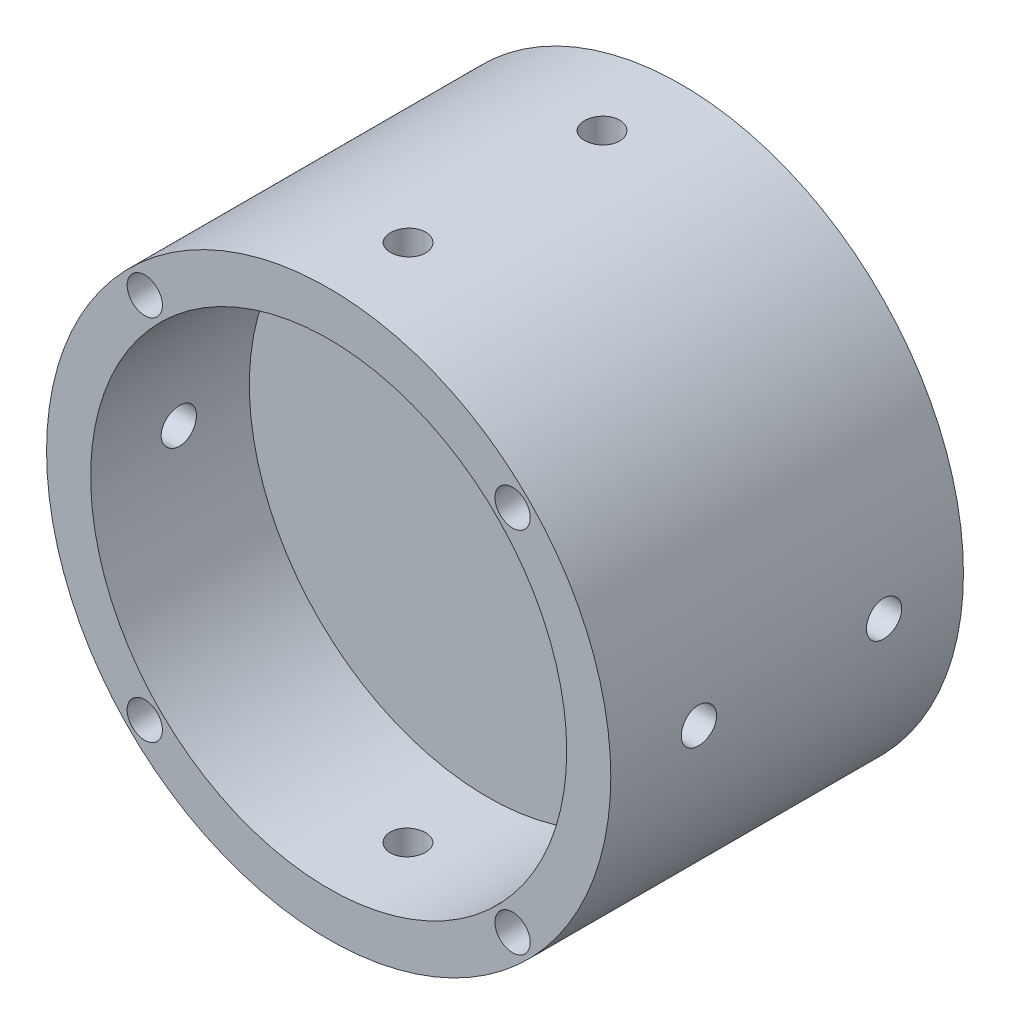
from build123d import *

# Parameters (mm, degrees)
SKETCH1_R               = 80
BOSS_EXTRUDE1_DEPTH     = 100
SKETCH3_R               = 67.5
CUT_EXTRUDE1_DEPTH      = 45
CUT_EXTRUDE5_START      = 45
SKETCH2_R               = 67.5
CUT_EXTRUDE5_DEPTH      = 45
CUT_EXTRUDE6_DEPTH      = 106
CUT_EXTRUDE6_DEPTH_BACK = 92
SKETCH5_R               = 5
CUT_EXTRUDE7_DEPTH      = 98
CUT_EXTRUDE7_DEPTH_BACK = 120
SKETCH5_3_R             = 5
CUT_EXTRUDE8_DEPTH      = 118
CUT_EXTRUDE8_DEPTH_BACK = 146
SKETCH6_R               = 5
SKETCH7_R               = 5
CUT_EXTRUDE15_DEPTH     = 118


with BuildPart() as part:
    # Sketch1 → Boss-Extrude1 (new body)
    with BuildSketch(Plane.XY):
        Circle(SKETCH1_R)
    extrude(amount=BOSS_EXTRUDE1_DEPTH)

    # Sketch3 → Cut-Extrude1 (cut)
    with BuildSketch(Plane.XY.offset(100)):
        Circle(SKETCH3_R)
    extrude(amount=-CUT_EXTRUDE1_DEPTH, mode=Mode.SUBTRACT)

    # Sketch2 → Cut-Extrude5 (cut)
    with BuildSketch(Plane.XY.offset(CUT_EXTRUDE5_START)):
        Circle(SKETCH2_R)
    extrude(amount=-CUT_EXTRUDE5_DEPTH, mode=Mode.SUBTRACT)

    # Sketch5 → Cut-Extrude6 (cut, two sides: drawn at the far end of the back side and taken through both)
    with BuildSketch(Plane(origin=(0, 0, 0), x_dir=(0, 0, -1), z_dir=(1, 0, 0)).offset(-CUT_EXTRUDE6_DEPTH_BACK)):
        with Locations((-75, 0)):
            Circle(SKETCH5_R)
    extrude(amount=CUT_EXTRUDE6_DEPTH + CUT_EXTRUDE6_DEPTH_BACK, mode=Mode.SUBTRACT)

    # Sketch5<3> → Cut-Extrude7 (cut, two sides: drawn at the far end of the back side and taken through both)
    with BuildSketch(Plane(origin=(0, 0, 0), x_dir=(0, 0, -1), z_dir=(1, 0, 0)).offset(-CUT_EXTRUDE7_DEPTH_BACK)):
        with Locations((-75, 0)):
            Circle(SKETCH5_3_R)
        with Locations((-22.5, 0)):
            Circle(SKETCH5_3_R)
    extrude(amount=CUT_EXTRUDE7_DEPTH + CUT_EXTRUDE7_DEPTH_BACK, mode=Mode.SUBTRACT)

    # Sketch6 → Cut-Extrude8 (cut, two sides: drawn at the far end of the back side and taken through both)
    with BuildSketch(Plane(origin=(0, 0, 0), x_dir=(1, 0, 0), z_dir=(0, 1, 0)).offset(-CUT_EXTRUDE8_DEPTH_BACK)):
        with Locations((0, -22.5)):
            Circle(SKETCH6_R)
        with Locations((0, -77.5)):
            Circle(SKETCH6_R)
    extrude(amount=CUT_EXTRUDE8_DEPTH + CUT_EXTRUDE8_DEPTH_BACK, mode=Mode.SUBTRACT)

    # Sketch7 → Cut-Extrude15 (cut)
    with BuildSketch(Plane.XY):
        with Locations((-52.149125113, 52.149125113)):
            Circle(SKETCH7_R)
        with Locations((52.149125113, 52.149125113)):
            Circle(SKETCH7_R)
        with Locations((52.149125113, -52.149125113)):
            Circle(SKETCH7_R)
        with Locations((-52.149125113, -52.149125113)):
            Circle(SKETCH7_R)
    extrude(amount=CUT_EXTRUDE15_DEPTH, mode=Mode.SUBTRACT)


solid = part.part
